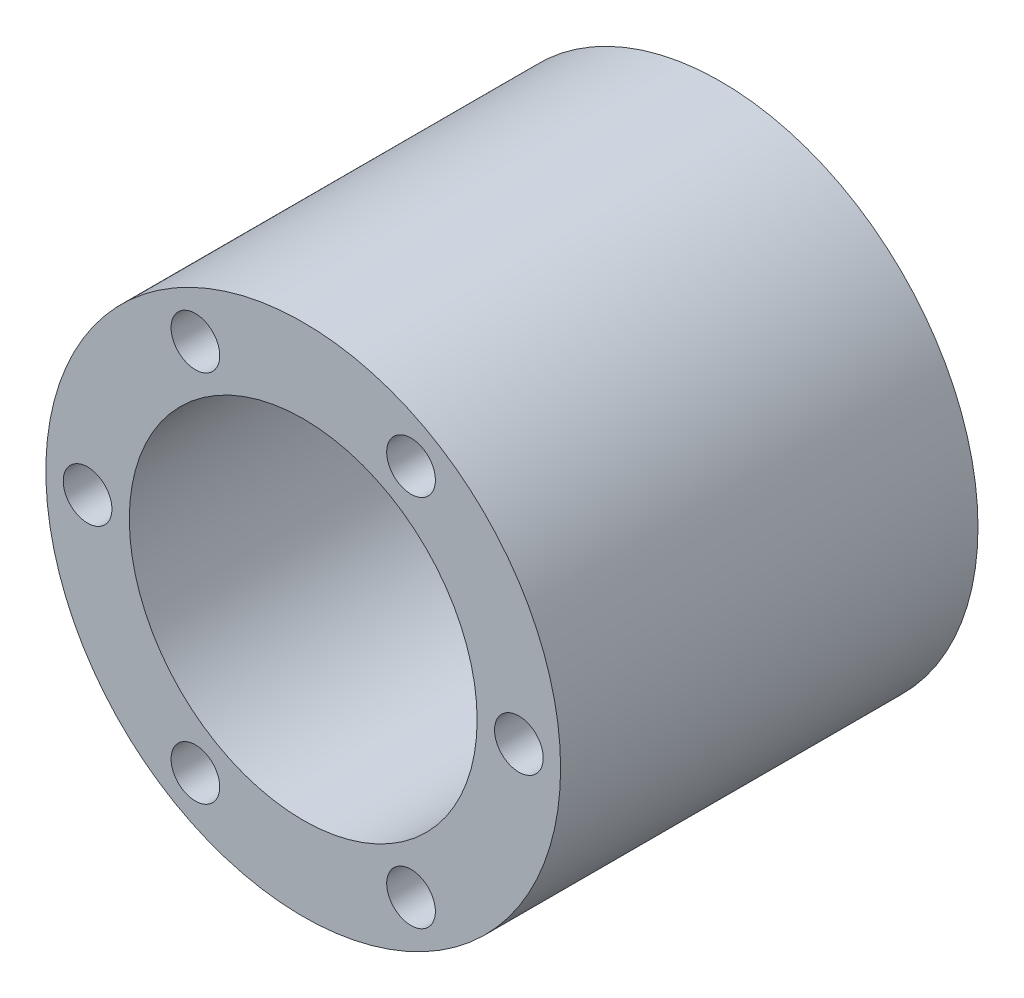
from build123d import *

# Parameters (mm, degrees)
SKETCH1_R           = 18.5
SKETCH1_R_2         = 1.75
SKETCH1_R_3         = 12.5
BOSS_EXTRUDE1_DEPTH = 30


with BuildPart() as part:
    # Sketch1 → Boss-Extrude1 (new body)
    with BuildSketch(Plane.XY):
        Circle(SKETCH1_R)
        with Locations((-15.5, 0)):
            Circle(SKETCH1_R_2, mode=Mode.SUBTRACT)
        with Locations((-7.75, 13.423393759)):
            Circle(SKETCH1_R_2, mode=Mode.SUBTRACT)
        with Locations((7.75, 13.423393759)):
            Circle(SKETCH1_R_2, mode=Mode.SUBTRACT)
        with Locations((15.5, 0)):
            Circle(SKETCH1_R_2, mode=Mode.SUBTRACT)
        with Locations((7.75, -13.423393759)):
            Circle(SKETCH1_R_2, mode=Mode.SUBTRACT)
        with Locations((-7.75, -13.423393759)):
            Circle(SKETCH1_R_2, mode=Mode.SUBTRACT)
        Circle(SKETCH1_R_3, mode=Mode.SUBTRACT)
    extrude(amount=BOSS_EXTRUDE1_DEPTH)


solid = part.part
